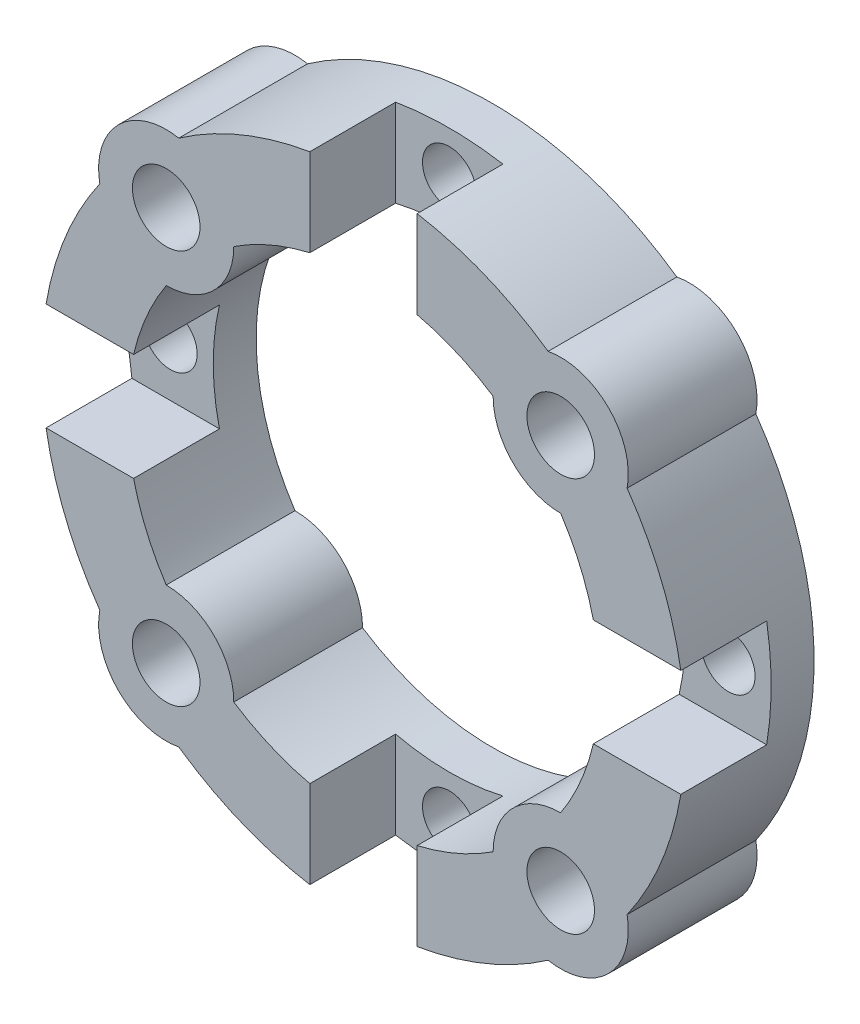
from build123d import *

# Parameters (mm, degrees)
SKETCH1_R           = 19.05
SKETCH1_R_2         = 13.97
BOSS_EXTRUDE1_DEPTH = 7.62
SKETCH2_R           = 1.5875
CUT_EXTRUDE1_DEPTH  = 28.99766776
CUT_EXTRUDE2_START  = -5.08
SKETCH3_R           = 1.5875
CUT_EXTRUDE2_DEPTH  = 5.08
SKETCH4_R           = 1.5
CUT_EXTRUDE3_DEPTH  = 28.99766776
SKETCH5_R           = 2
CUT_EXTRUDE4_DEPTH  = 5.7
SKETCH6_R           = 4
SKETCH6_R_2         = 2
BOSS_EXTRUDE2_DEPTH = 7.62
CIRPATTERN1_COUNT   = 4


with BuildPart() as part:
    # Sketch1 → Boss-Extrude1 (new body)
    with BuildSketch(Plane.XY):
        with Locations(Location((0, 0, 0), (0, 0, 180))):
            Circle(SKETCH1_R)
        with Locations(Location((0, 0, 0), (0, 0, 180))):
            Circle(SKETCH1_R_2, mode=Mode.SUBTRACT)
    extrude(amount=BOSS_EXTRUDE1_DEPTH)

    # Sketch2 → Cut-Extrude1 (cut, through all)
    with BuildSketch(Plane.XY.offset(7.62)):
        with Locations((0, 16.51)):
            Circle(SKETCH2_R)
        with Locations((16.51, 0)):
            Circle(SKETCH2_R)
        with Locations((0, -16.51)):
            Circle(SKETCH2_R)
        with Locations((-16.51, 0)):
            Circle(SKETCH2_R)
    extrude(amount=-CUT_EXTRUDE1_DEPTH, mode=Mode.SUBTRACT)

    # Sketch3 → Cut-Extrude2 (cut)
    # profile 1 of 4: a face of its own
    with BuildSketch(Plane.XY.offset(7.62).offset(CUT_EXTRUDE2_START)):
        with BuildLine():
            ThreePointArc((-18.783553311, 3.175), (-19.05, 0), (-18.783553311, -3.175))
            Line((-18.783553311, -3.175), (-13.604421156, -3.175))
            ThreePointArc((-13.604421156, -3.175), (-13.97, 0), (-13.604421156, 3.175))
            Line((-13.604421156, 3.175), (-18.783553311, 3.175))
        make_face()
        with Locations((-16.51, 0)):
            Circle(SKETCH3_R, mode=Mode.SUBTRACT)
    # profile 2 of 4: a face of its own
    with BuildSketch(Plane.XY.offset(7.62).offset(CUT_EXTRUDE2_START)):
        with BuildLine():
            Line((-3.175, -13.604421156), (-3.175, -18.783553311))
            ThreePointArc((-3.175, -18.783553311), (0, -19.05), (3.175, -18.783553311))
            Line((3.175, -18.783553311), (3.175, -13.604421156))
            ThreePointArc((3.175, -13.604421156), (0, -13.97), (-3.175, -13.604421156))
        make_face()
        with Locations((0, -16.51)):
            Circle(SKETCH3_R, mode=Mode.SUBTRACT)
    # profile 3 of 4: a face of its own
    with BuildSketch(Plane.XY.offset(7.62).offset(CUT_EXTRUDE2_START)):
        with BuildLine():
            Line((13.604421156, -3.175), (18.783553311, -3.175))
            ThreePointArc((18.783553311, -3.175), (18.983271459, -1.593080258), (19.05, 0))
            ThreePointArc((19.05, 0), (18.983271459, 1.593080258), (18.783553311, 3.175))
            Line((18.783553311, 3.175), (13.604421156, 3.175))
            ThreePointArc((13.604421156, 3.175), (13.878304355, 1.597988806), (13.97, 0))
            ThreePointArc((13.97, 0), (13.878304355, -1.597988806), (13.604421156, -3.175))
        make_face()
        with Locations((16.51, 0)):
            Circle(SKETCH3_R, mode=Mode.SUBTRACT)
    # profile 4 of 4: a face of its own
    with BuildSketch(Plane.XY.offset(7.62).offset(CUT_EXTRUDE2_START)):
        with BuildLine():
            ThreePointArc((3.175, 18.783553311), (0, 19.05), (-3.175, 18.783553311))
            Line((-3.175, 18.783553311), (-3.175, 13.604421156))
            ThreePointArc((-3.175, 13.604421156), (0, 13.97), (3.175, 13.604421156))
            Line((3.175, 13.604421156), (3.175, 18.783553311))
        make_face()
        with Locations((0, 16.51)):
            Circle(SKETCH3_R, mode=Mode.SUBTRACT)
    extrude(amount=CUT_EXTRUDE2_DEPTH, mode=Mode.SUBTRACT)

    # Sketch4 → Cut-Extrude3 (cut, through all)
    with BuildSketch(Plane.XY.offset(7.62)):
        with Locations((-11.674332957, 11.674332957)):
            Circle(SKETCH4_R)
    cut_extrude3 = extrude(amount=-CUT_EXTRUDE3_DEPTH, mode=Mode.SUBTRACT)

    # Sketch5 → Cut-Extrude4 (cut)
    with BuildSketch(Plane.XY.offset(7.62)):
        with Locations((-11.674332957, 11.674332957)):
            Circle(SKETCH5_R)
    cut_extrude4 = extrude(amount=-CUT_EXTRUDE4_DEPTH, mode=Mode.SUBTRACT)

    # Sketch6 → Boss-Extrude2 (add)
    with BuildSketch(Plane.XY.offset(7.62)):
        with Locations((-11.674332957, 11.674332957)):
            Circle(SKETCH6_R)
        with Locations((-11.674332957, 11.674332957)):
            Circle(SKETCH6_R_2, mode=Mode.SUBTRACT)
    boss_extrude2 = extrude(amount=-BOSS_EXTRUDE2_DEPTH)

    # CirPattern1: Cut-Extrude3, Cut-Extrude4, Boss-Extrude2 ×4 about axis
    cirpattern1_axis = Axis((0, 0, 0), (0, 0, 1))
    add([cut_extrude3.rotate(cirpattern1_axis, i * 360 / CIRPATTERN1_COUNT) for i in range(1, CIRPATTERN1_COUNT)], mode=Mode.SUBTRACT)
    add([cut_extrude4.rotate(cirpattern1_axis, i * 360 / CIRPATTERN1_COUNT) for i in range(1, CIRPATTERN1_COUNT)], mode=Mode.SUBTRACT)
    add([boss_extrude2.rotate(cirpattern1_axis, i * 360 / CIRPATTERN1_COUNT) for i in range(1, CIRPATTERN1_COUNT)])


solid = part.part
